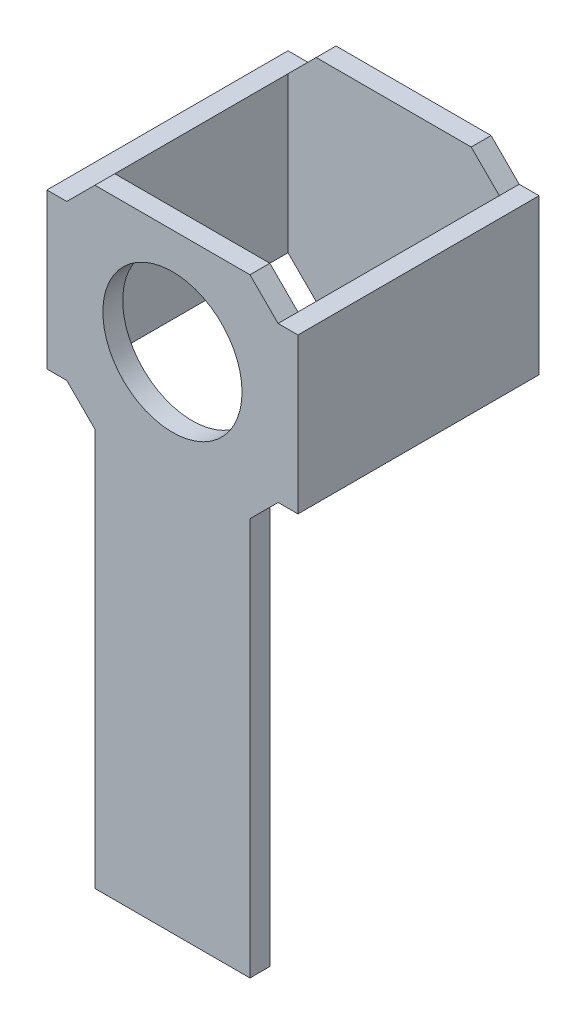
from build123d import *

# Parameters (mm, degrees)
SKETCH1_W           = 42.5
SKETCH1_H           = 42.5
SKETCH1_R           = 14
BOSS_EXTRUDE1_DEPTH = 4
CUT_EXTRUDE1_DEPTH  = 10
SKETCH3_W           = 31.186291502
SKETCH3_H           = 44.5
BOSS_EXTRUDE2_DEPTH = 4
SKETCH4_W           = 31.186291502
SKETCH4_H           = 44.5
BOSS_EXTRUDE3_DEPTH = 4
BOSS_EXTRUDE5_DEPTH = 4
SKETCH8_W           = 31.186291502
SKETCH8_H           = 80
BOSS_EXTRUDE6_DEPTH = 4


with BuildPart() as part:
    # Sketch1 → Boss-Extrude1 (new body)
    with BuildSketch(Plane(origin=(0, 0, 0), x_dir=(0, 1, 0), z_dir=(0, 0, 1))):
        Rectangle(SKETCH1_W, SKETCH1_H)
        with Locations(Location((0, 0, 0), (0, 0, 270))):
            Circle(SKETCH1_R, mode=Mode.SUBTRACT)
    extrude(amount=BOSS_EXTRUDE1_DEPTH)

    # Sketch2 → Cut-Extrude1 (cut)
    with BuildSketch(Plane.XY.offset(4)):
        Polygon((-15.593145751, 21.25), (-21.25, 15.593145751), (-21.25, 21.25), align=None)
        Polygon((-21.25, -15.593145751), (-15.593145751, -21.25), (-21.25, -21.25), align=None)
        Polygon((15.593145751, -21.25), (21.25, -15.593145751), (21.25, -21.25), align=None)
        Polygon((15.593145751, 21.25), (21.25, 15.593145751), (21.25, 21.25), align=None)
    extrude(amount=-CUT_EXTRUDE1_DEPTH, mode=Mode.SUBTRACT)

    # Sketch3 → Boss-Extrude2 (add)
    with BuildSketch(Plane(origin=(-21.25, 0, 0), x_dir=(0, -1, 0), z_dir=(-1, 0, 0))):
        with Locations((0, -18.25)):
            Rectangle(SKETCH3_W, SKETCH3_H)
    extrude(amount=BOSS_EXTRUDE2_DEPTH)

    # Sketch4 → Boss-Extrude3 (add)
    with BuildSketch(Plane.YZ.offset(21.25)):
        with Locations((0, -18.25)):
            Rectangle(SKETCH4_W, SKETCH4_H)
    extrude(amount=BOSS_EXTRUDE3_DEPTH)

    # Sketch6 → Boss-Extrude5 (add)
    with BuildSketch(Plane(origin=(0, 0, -40.5), x_dir=(1, 0, 0), z_dir=(0, 0, -1))):
        Polygon((-21.25, 15.593145751), (-25.25, 15.593145751), (-25.25, -15.593145751), (-21.25, -15.593145751), (-15.593145751, -21.25), (15.593145751, -21.25), (21.25, -15.593145751), (25.25, -15.593145751), (25.25, 15.593145751), (21.25, 15.593145751), (15.593145751, 21.25), (-15.593145751, 21.25), align=None)
    extrude(amount=BOSS_EXTRUDE5_DEPTH)

    # Sketch8 → Boss-Extrude6 (add)
    with BuildSketch(Plane.XY.offset(4)):
        with Locations((0, -61.25)):
            Rectangle(SKETCH8_W, SKETCH8_H)
    extrude(amount=-BOSS_EXTRUDE6_DEPTH)


solid = part.part
